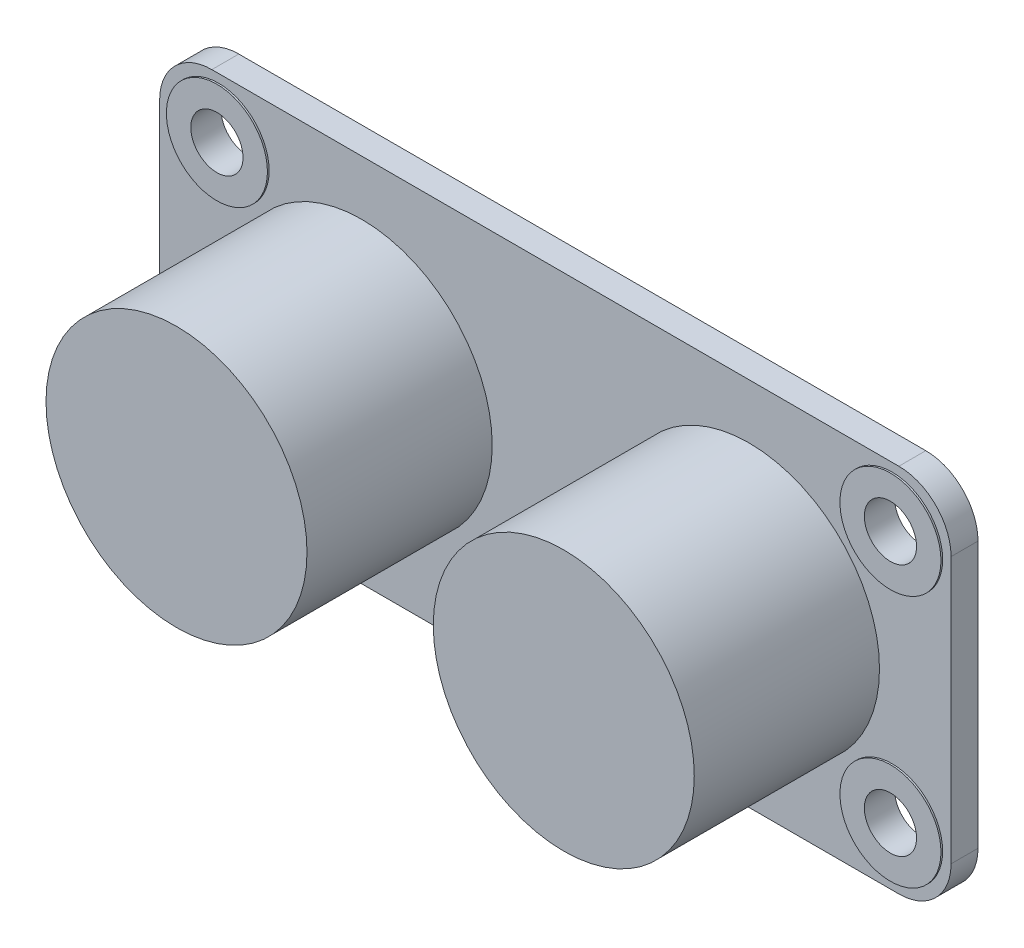
from build123d import *

# Parameters (mm, degrees)
SKETCH1_W                = 47
SKETCH1_H                = 22
SKETCH1_R                = 1.55
BOSS_EXTRUDE1_DEPTH      = 1.6
FILLET1_R                = 3.1
BOSS_EXTRUDE4_DEPTH      = 0.1
BOSS_EXTRUDE4_DEPTH_BACK = 1.7
SKETCH2_R                = 3
SKETCH2_R_2              = 1.55
SKETCH3_R                = 7.75
BOSS_EXTRUDE8_DEPTH      = 11


with BuildPart() as part:
    # Sketch1 → Boss-Extrude1 (new body)
    with BuildSketch(Plane.XY):
        Rectangle(SKETCH1_W, SKETCH1_H)
        with Locations((-20, 7.5)):
            Circle(SKETCH1_R, mode=Mode.SUBTRACT)
        with Locations((20, 7.5)):
            Circle(SKETCH1_R, mode=Mode.SUBTRACT)
        with Locations((20, -7.5)):
            Circle(SKETCH1_R, mode=Mode.SUBTRACT)
        with Locations((-20, -7.5)):
            Circle(SKETCH1_R, mode=Mode.SUBTRACT)
    extrude(amount=BOSS_EXTRUDE1_DEPTH)

    # Fillet1
    fillet1_edges = [part.edges().sort_by_distance(p)[0] for p in [
        (23.5, -11, 0.8),
        (-23.5, -11, 0.8),
        (-23.5, 11, 0.8),
        (23.5, 11, 0.8),
    ]]
    fillet(fillet1_edges, radius=FILLET1_R)

    # Sketch2 → Boss-Extrude4 (add, two sides: drawn at the far end of the back side and taken through both)
    # profile 1 of 4: a face of its own
    with BuildSketch(Plane.XY.offset(1.6).offset(-BOSS_EXTRUDE4_DEPTH_BACK)):
        with Locations((-20, 7.5)):
            Circle(SKETCH2_R)
        with Locations((-20, 7.5)):
            Circle(SKETCH2_R_2, mode=Mode.SUBTRACT)
    # profile 2 of 4: a face of its own
    with BuildSketch(Plane.XY.offset(1.6).offset(-BOSS_EXTRUDE4_DEPTH_BACK)):
        with Locations((-20, -7.5)):
            Circle(SKETCH2_R)
        with Locations((-20, -7.5)):
            Circle(SKETCH2_R_2, mode=Mode.SUBTRACT)
    # profile 3 of 4: a face of its own
    with BuildSketch(Plane.XY.offset(1.6).offset(-BOSS_EXTRUDE4_DEPTH_BACK)):
        with Locations((20, 7.5)):
            Circle(SKETCH2_R)
        with Locations((20, 7.5)):
            Circle(SKETCH2_R_2, mode=Mode.SUBTRACT)
    # profile 4 of 4: a face of its own
    with BuildSketch(Plane.XY.offset(1.6).offset(-BOSS_EXTRUDE4_DEPTH_BACK)):
        with Locations((20, -7.5)):
            Circle(SKETCH2_R)
        with Locations((20, -7.5)):
            Circle(SKETCH2_R_2, mode=Mode.SUBTRACT)
    extrude(amount=BOSS_EXTRUDE4_DEPTH + BOSS_EXTRUDE4_DEPTH_BACK)

    # Sketch3 → Boss-Extrude8 (add)
    with BuildSketch(Plane.XY.offset(1.6)):
        with Locations(Location((11.5, 0, 0), (0, 0, 180))):
            Circle(SKETCH3_R)
        with Locations(Location((-11.5, 0, 0), (0, 0, 180))):
            Circle(SKETCH3_R)
    extrude(amount=BOSS_EXTRUDE8_DEPTH)


solid = part.part
